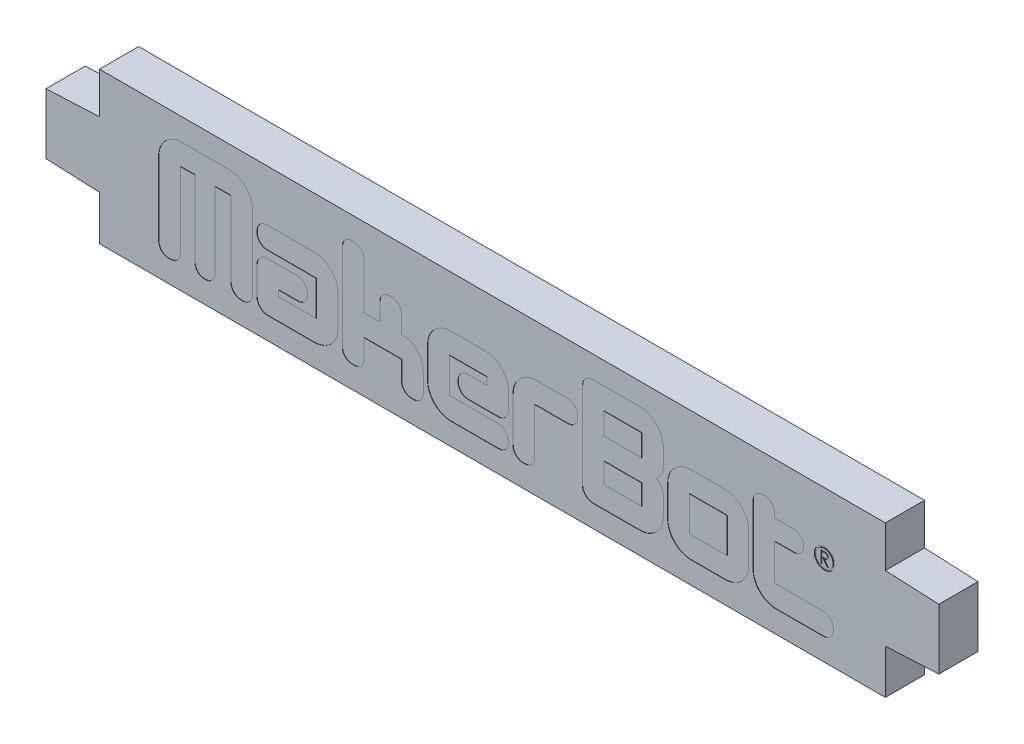
from build123d import *

# Parameters (mm, degrees)
BOSS_EXTRUDE1_DEPTH = 6.4
SKETCH5_W           = 6.148648648
SKETCH5_H           = 3.547297298
SKETCH5_H_2         = 3.310810811
SKETCH5_W_2         = 6.148648649
SKETCH5_H_3         = 5.675675676
CUT_EXTRUDE3_DEPTH  = 0.05
SKETCH11_R          = 1.655
SKETCH11_R_2        = 1.405
CUT_EXTRUDE6_DEPTH  = 0.1
CUT_EXTRUDE7_DEPTH  = 0.1


with BuildPart() as part:
    # Sketch1 → Boss-Extrude1 (new body)
    with BuildSketch(Plane.XY):
        Polygon((63.31728793, 2.089265908), (-65.18271207, 2.089265908), (-65.18271207, 9.364487271), (-73.93271207, 9.764487271), (-73.93271207, 19.664487271), (-65.18271207, 20.064487271), (-65.18271207, 26.809708634), (63.31728793, 26.809708634), (63.31728793, 20.064487271), (72.06728793, 19.664487271), (72.06728793, 9.764487271), (63.31728793, 9.364487271), align=None)
    extrude(amount=BOSS_EXTRUDE1_DEPTH)

    # Sketch5 → Cut-Extrude3 (cut)
    # profile 1 of 8: a face of its own
    with BuildSketch(Plane.XY.offset(6.4)):
        with BuildLine():
            add(Edge.make_bspline(
                [(-41.897176837, 5.680549813), (-42.025779806, 5.685864392), (-42.273995534, 5.696122025), (-42.62809114, 5.785149455), (-42.94019404, 5.939774007), (-43.209577411, 6.149072184), (-43.430201601, 6.406640025), (-43.581460915, 6.712239714), (-43.683874665, 7.049824022), (-43.692322648, 7.289574607), (-43.696691195, 7.413552347)],
                knots=[0, 0, 0, 0, 1.097172578, 2.117645432, 3.091403139, 4.050852726, 5.013813102, 5.959381721, 6.944773204, 8, 8, 8, 8], degree=3))
            Line((-43.696691195, 7.413552347), (-43.696691195, 19.633252516))
            Line((-43.696691195, 19.633252516), (-46.298042546, 19.633252516))
            Line((-46.298042546, 19.633252516), (-46.298042546, 7.413552347))
            add(Edge.make_bspline(
                [(-46.298042546, 7.413552347), (-46.303921163, 7.289954322), (-46.315228965, 7.052207571), (-46.396100328, 6.712274166), (-46.539380918, 6.410964897), (-46.735132537, 6.151328403), (-46.979936248, 5.939263768), (-47.268786576, 5.786220541), (-47.599524345, 5.695496881), (-47.832152411, 5.685672423), (-47.953447952, 5.680549813)],
                knots=[0, 0, 0, 0, 1.097972027, 2.112002056, 3.081338975, 4.042298254, 4.981317233, 5.93608619, 6.923846351, 8, 8, 8, 8], degree=3))
            add(Edge.make_bspline(
                [(-47.953447952, 5.680549813), (-48.074720706, 5.685696599), (-48.30730507, 5.695567423), (-48.638346678, 5.785968718), (-48.926937026, 5.940614327), (-49.175749845, 6.148787762), (-49.366853265, 6.41243888), (-49.511071843, 6.712048382), (-49.591589758, 7.052270648), (-49.602948341, 7.289975898), (-49.608853357, 7.413552347)],
                knots=[0, 0, 0, 0, 1.075918024, 2.063461914, 3.018021823, 3.965152157, 4.919335687, 5.888460369, 6.902268375, 8, 8, 8, 8], degree=3))
            Line((-49.608853357, 7.413552347), (-49.608853357, 19.633252516))
            Line((-49.608853357, 19.633252516), (-51.973718222, 19.633252516))
            Line((-51.973718222, 19.633252516), (-51.973718222, 7.413552347))
            add(Edge.make_bspline(
                [(-51.973718222, 7.413552347), (-51.978609645, 7.289747287), (-51.988055484, 7.050667051), (-52.083313102, 6.710496809), (-52.241267, 6.407745944), (-52.460448049, 6.148892263), (-52.730319591, 5.939822841), (-53.04228888, 5.785135679), (-53.396422035, 5.696125844), (-53.644632393, 5.685865695), (-53.77323258, 5.680549813)],
                knots=[0, 0, 0, 0, 1.054966195, 2.037247655, 2.987425122, 3.950147683, 4.909360322, 5.882877547, 6.903098382, 8, 8, 8, 8], degree=3))
            add(Edge.make_bspline(
                [(-53.77323258, 5.680549813), (-53.898315763, 5.685332409), (-54.139908299, 5.694569778), (-54.480812981, 5.790721453), (-54.786671197, 5.940734427), (-55.047751843, 6.152253744), (-55.263056827, 6.412314756), (-55.40898607, 6.719082566), (-55.507691241, 7.058926733), (-55.516455442, 7.299477393), (-55.521015519, 7.424637651)],
                knots=[0, 0, 0, 0, 1.078530095, 2.083132322, 3.035265688, 4.004502848, 4.965462051, 5.927128535, 6.921469905, 8, 8, 8, 8], degree=3))
            Line((-55.521015519, 7.424637651), (-55.521015519, 19.315473799))
            add(Edge.make_bspline(
                [(-55.521015519, 19.315473799), (-55.517226477, 19.446190309), (-55.509761278, 19.703728906), (-55.457784963, 20.082853835), (-55.368197866, 20.446338858), (-55.246042281, 20.795501091), (-55.089211353, 21.131090606), (-54.898109709, 21.453316666), (-54.664598287, 21.756745445), (-54.406183653, 22.047032222), (-54.119158085, 22.310330756), (-53.815913366, 22.546186468), (-53.493150965, 22.742334965), (-53.15438562, 22.901454066), (-52.802268739, 23.028609377), (-52.433102693, 23.117459409), (-52.047871242, 23.169292885), (-51.785424774, 23.176760379), (-51.652244404, 23.180549813)],
                knots=[0, 0, 0, 0, 1.030779681, 2.030849458, 3.010906287, 3.97861049, 4.943336309, 5.927859644, 6.926418741, 7.958159096, 8.989259101, 9.993706395, 10.98324833, 11.960895376, 12.94100034, 13.930494598, 14.949814424, 16, 16, 16, 16], degree=3))
            Line((-51.652244404, 23.180549813), (-44.018165013, 23.180549813))
            add(Edge.make_bspline(
                [(-44.018165013, 23.180549813), (-43.884990403, 23.17674533), (-43.622555286, 23.169248181), (-43.237241421, 23.117630014), (-42.867247542, 23.027717912), (-42.514025603, 22.903276283), (-42.176578762, 22.741151747), (-41.85442101, 22.546352375), (-41.551272165, 22.310284695), (-41.26422011, 22.047044722), (-41.005812592, 21.756742213), (-40.772299328, 21.453317507), (-40.581198163, 21.131090386), (-40.42436711, 20.79550115), (-40.302211558, 20.446338842), (-40.212624452, 20.082853839), (-40.16064814, 19.703728905), (-40.15318294, 19.446190309), (-40.149393898, 19.315473799)],
                knots=[0, 0, 0, 0, 1.050160809, 2.069456595, 3.058927517, 4.04816003, 5.017010697, 6.006529294, 7.0109529, 8.042028588, 9.073744611, 10.072280157, 11.056780273, 12.02148334, 12.989164722, 13.969198437, 14.969244628, 16, 16, 16, 16], degree=3))
            Line((-40.149393898, 19.315473799), (-40.149393898, 7.424637651))
            add(Edge.make_bspline(
                [(-40.149393898, 7.424637651), (-40.15422324, 7.303230992), (-40.163593056, 7.067679665), (-40.261161868, 6.731699474), (-40.412636723, 6.427537208), (-40.625482978, 6.164316085), (-40.884957866, 5.948250641), (-41.187655401, 5.789217278), (-41.530736224, 5.695070623), (-41.772173855, 5.685503261), (-41.897176837, 5.680549813)],
                knots=[0, 0, 0, 0, 1.049433475, 2.036094644, 3.005048059, 3.976818887, 4.947064632, 5.911422194, 6.918650536, 8, 8, 8, 8], degree=3))
        make_face()
    # profile 2 of 8: a face of its own
    with BuildSketch(Plane.XY.offset(6.4)):
        with BuildLine():
            Line((-30.157839844, 5.680549813), (-37.692151499, 5.680549813))
            add(Edge.make_bspline(
                [(-37.692151499, 5.680549813), (-37.804904387, 5.687114784), (-38.028437736, 5.700129882), (-38.35270279, 5.799841918), (-38.652522005, 5.966898241), (-38.922206157, 6.190517595), (-39.147937167, 6.454416509), (-39.31579874, 6.745804582), (-39.421429188, 7.057859133), (-39.433738521, 7.274796071), (-39.439934438, 7.383991536)],
                knots=[0, 0, 0, 0, 1.003924849, 1.990287682, 2.992650562, 4.045507142, 5.096989086, 6.070622535, 7.02884557, 8, 8, 8, 8], degree=3))
            Line((-39.439934438, 7.383991536), (-39.439934438, 12.04351434))
            add(Edge.make_bspline(
                [(-39.439934438, 12.04351434), (-39.433429632, 12.151409301), (-39.420527191, 12.36542159), (-39.319328108, 12.67568845), (-39.153594587, 12.965091322), (-38.924505505, 13.221124947), (-38.660197166, 13.442510576), (-38.36450966, 13.604929989), (-38.045346736, 13.701108992), (-37.825817267, 13.714360265), (-37.714322107, 13.721090353)],
                knots=[0, 0, 0, 0, 0.973230211, 1.930425878, 2.917237436, 3.966087913, 5.017532224, 6.018359482, 6.993559603, 8, 8, 8, 8], degree=3))
            Line((-37.714322107, 13.721090353), (-32.914385452, 13.721090353))
            add(Edge.make_bspline(
                [(-32.914385452, 13.721090353), (-32.789428114, 13.715853206), (-32.548399273, 13.705751329), (-32.204483514, 13.615491281), (-31.899339521, 13.462106866), (-31.639299861, 13.248441379), (-31.425342402, 12.988402896), (-31.272470484, 12.681597814), (-31.17682046, 12.334944104), (-31.167667564, 12.089743679), (-31.162907411, 11.96222211)],
                knots=[0, 0, 0, 0, 1.071862608, 2.067504053, 3.027956681, 3.982975222, 4.937993763, 5.898446391, 6.907043446, 8, 8, 8, 8], degree=3))
            add(Edge.make_bspline(
                [(-31.162907411, 11.96222211), (-31.168146009, 11.833620429), (-31.178208345, 11.586601386), (-31.267330176, 11.234695058), (-31.423339074, 10.926128996), (-31.629815968, 10.657808423), (-31.887435188, 10.441774907), (-32.186169618, 10.282435137), (-32.525732152, 10.188311798), (-32.764748017, 10.178746395), (-32.888519742, 10.173793056)],
                knots=[0, 0, 0, 0, 1.102928933, 2.118513913, 3.087911514, 4.052394887, 5.005508706, 5.951557965, 6.939236919, 8, 8, 8, 8], degree=3))
            Line((-32.888519742, 10.173793056), (-35.892637141, 10.173793056))
            Line((-35.892637141, 10.173793056), (-35.892637141, 9.22784711))
            Line((-35.892637141, 9.22784711), (-29.743988492, 9.22784711))
            Line((-29.743988492, 9.22784711), (-29.743988492, 14.903522786))
            Line((-29.743988492, 14.903522786), (-37.692151499, 14.903522786))
            add(Edge.make_bspline(
                [(-37.692151499, 14.903522786), (-37.818510237, 14.908136533), (-38.061419643, 14.917005905), (-38.404164125, 15.014723411), (-38.711573826, 15.161748416), (-38.97235257, 15.375531966), (-39.180442853, 15.641567405), (-39.335370858, 15.949751959), (-39.424673004, 16.301520534), (-39.434709364, 16.548559422), (-39.439934438, 16.677171435)],
                knots=[0, 0, 0, 0, 1.077329427, 2.071035653, 3.022271821, 3.972808379, 4.92497656, 5.890328168, 6.901674382, 8, 8, 8, 8], degree=3))
            add(Edge.make_bspline(
                [(-39.439934438, 16.677171435), (-39.434753544, 16.805804443), (-39.424802043, 17.05288366), (-39.335323462, 17.402758827), (-39.183702415, 17.710629814), (-38.976028245, 17.975326225), (-38.714328824, 18.188170458), (-38.408929631, 18.340554635), (-38.063768257, 18.43736467), (-37.819702405, 18.44620175), (-37.692151499, 18.450820083)],
                knots=[0, 0, 0, 0, 1.098175809, 2.109384079, 3.060490501, 4.01252881, 4.962935717, 5.918750472, 6.91232116, 8, 8, 8, 8], degree=3))
            Line((-37.692151499, 18.450820083), (-30.157839844, 18.450820083))
            add(Edge.make_bspline(
                [(-30.157839844, 18.450820083), (-30.023416487, 18.44706834), (-29.757272772, 18.439640295), (-29.366440112, 18.386776307), (-28.989685178, 18.302674094), (-28.629307877, 18.179808144), (-28.285250169, 18.020793127), (-27.957716375, 17.825269294), (-27.642085846, 17.601189581), (-27.349060786, 17.339293319), (-27.082893803, 17.053148867), (-26.842168425, 16.753429263), (-26.642691521, 16.434145008), (-26.478977469, 16.099915536), (-26.351532902, 15.749483625), (-26.265588064, 15.383372718), (-26.206342602, 15.002733202), (-26.199949083, 14.743635744), (-26.196691195, 14.611609779)],
                knots=[0, 0, 0, 0, 1.050330879, 2.079541602, 3.076651564, 4.062923053, 5.049194541, 6.033114514, 7.040210619, 8.069826392, 9.098181484, 10.091893812, 11.069389041, 12.033714251, 12.995923234, 13.976494365, 14.968900403, 16, 16, 16, 16], degree=3))
            Line((-26.196691195, 14.611609779), (-26.196691195, 9.545625826))
            add(Edge.make_bspline(
                [(-26.196691195, 9.545625826), (-26.199961444, 9.413604471), (-26.206379221, 9.154516059), (-26.265448672, 8.773810909), (-26.352312463, 8.406814019), (-26.477942531, 8.054448734), (-26.643756068, 7.718790573), (-26.841897802, 7.39638529), (-27.083012128, 7.093258803), (-27.347724913, 6.803089016), (-27.643266199, 6.541563028), (-27.957574964, 6.313627248), (-28.284286391, 6.113885266), (-28.629339137, 5.955117609), (-28.990215367, 5.833514971), (-29.36586566, 5.743333375), (-29.757349822, 5.692065868), (-30.023442344, 5.684414401), (-30.157839844, 5.680549813)],
                knots=[0, 0, 0, 0, 1.02823351, 2.017881014, 2.995726508, 3.964293243, 4.925937974, 5.908858825, 6.907358576, 7.939884608, 8.966638418, 9.976562025, 10.962665069, 11.946195076, 12.929725084, 13.926238779, 14.952588665, 16, 16, 16, 16], degree=3))
        make_face()
    # profile 3 of 8: a face of its own
    with BuildSketch(Plane.XY.offset(6.4)):
        with BuildLine():
            add(Edge.make_bspline(
                [(-14.002856735, 5.680549813), (-14.131420869, 5.686056244), (-14.378065836, 5.696620104), (-14.729128276, 5.781756712), (-15.038347476, 5.929505863), (-15.308069625, 6.128759568), (-15.523032038, 6.38288775), (-15.682663528, 6.677742924), (-15.77677042, 7.01376522), (-15.786333006, 7.250363862), (-15.79128579, 7.372906232)],
                knots=[0, 0, 0, 0, 1.11165758, 2.13266903, 3.100393931, 4.05957168, 5.012094993, 5.95623431, 6.941465223, 8, 8, 8, 8], degree=3))
            Line((-15.79128579, 7.372906232), (-15.79128579, 10.410279543))
            Line((-15.79128579, 10.410279543), (-21.939934438, 10.410279543))
            Line((-21.939934438, 10.410279543), (-21.939934438, 7.372906232))
            add(Edge.make_bspline(
                [(-21.939934438, 7.372906232), (-21.944887222, 7.250363862), (-21.954449807, 7.01376522), (-22.0485567, 6.677742924), (-22.20818819, 6.38288775), (-22.423150602, 6.128759568), (-22.692872752, 5.929505863), (-23.002091951, 5.781756712), (-23.353154392, 5.696620104), (-23.599799358, 5.686056244), (-23.728363492, 5.680549813)],
                knots=[0, 0, 0, 0, 1.058534777, 2.04376569, 2.987905007, 3.94042832, 4.899606069, 5.86733097, 6.88834242, 8, 8, 8, 8], degree=3))
            add(Edge.make_bspline(
                [(-23.728363492, 5.680549813), (-23.855869927, 5.685513753), (-24.100723651, 5.695046129), (-24.447304361, 5.787794127), (-24.756854763, 5.930378598), (-25.017914072, 6.137122952), (-25.228810219, 6.39263997), (-25.380876265, 6.691365057), (-25.472693515, 7.031332225), (-25.482235467, 7.270070765), (-25.487231735, 7.39507684)],
                knots=[0, 0, 0, 0, 1.1024249, 2.117013491, 3.085962871, 4.035923036, 4.97594201, 5.935206377, 6.918851784, 8, 8, 8, 8], degree=3))
            Line((-25.487231735, 7.39507684), (-25.487231735, 21.491888495))
            add(Edge.make_bspline(
                [(-25.487231735, 21.491888495), (-25.48203219, 21.615600523), (-25.472055011, 21.852986101), (-25.382568581, 22.190311305), (-25.22746274, 22.484021438), (-25.017844839, 22.735341011), (-24.756483438, 22.938194688), (-24.446997344, 23.077263384), (-24.100195236, 23.165042191), (-23.855793514, 23.175235214), (-23.728363492, 23.180549813)],
                knots=[0, 0, 0, 0, 1.077450175, 2.067471824, 3.013888997, 3.951735592, 4.901255681, 5.871921522, 6.890428899, 8, 8, 8, 8], degree=3))
            add(Edge.make_bspline(
                [(-23.728363492, 23.180549813), (-23.599915322, 23.174582932), (-23.353782397, 23.163149169), (-23.001460365, 23.084256487), (-22.693895944, 22.93475246), (-22.42476792, 22.740170632), (-22.20598053, 22.492330087), (-22.049721019, 22.198853029), (-21.953862073, 21.864814357), (-21.944702444, 21.629276918), (-21.939934438, 21.506668901)],
                knots=[0, 0, 0, 0, 1.116575212, 2.139586118, 3.111591937, 4.068628304, 5.009178948, 5.957494847, 6.93678259, 8, 8, 8, 8], degree=3))
            Line((-21.939934438, 21.506668901), (-21.939934438, 13.95757684))
            Line((-21.939934438, 13.95757684), (-19.338583087, 13.95757684))
            Line((-19.338583087, 13.95757684), (-19.338583087, 16.813890185))
            add(Edge.make_bspline(
                [(-19.338583087, 16.813890185), (-19.333589422, 16.930315565), (-19.323905903, 17.156083065), (-19.229086158, 17.477229361), (-19.069382861, 17.761054628), (-18.853060925, 18.005007588), (-18.590892337, 18.20671302), (-18.283815968, 18.347772852), (-17.942877889, 18.43463802), (-17.703423705, 18.445307781), (-17.579714844, 18.450820083)],
                knots=[0, 0, 0, 0, 1.034404173, 2.005875728, 2.948390345, 3.911784286, 4.889854289, 5.870869924, 6.900030674, 8, 8, 8, 8], degree=3))
            add(Edge.make_bspline(
                [(-17.579714844, 18.450820083), (-17.451046483, 18.447068828), (-17.204120013, 18.439869823), (-16.855299593, 18.351417128), (-16.544511202, 18.213935264), (-16.276261054, 18.021404801), (-16.059873497, 17.778787429), (-15.899183754, 17.493738274), (-15.805902269, 17.165715639), (-15.796274272, 16.933965265), (-15.79128579, 16.813890185)],
                knots=[0, 0, 0, 0, 1.127268985, 2.16333331, 3.136231652, 4.096728943, 5.038846223, 5.968466367, 6.947416733, 8, 8, 8, 8], degree=3))
            Line((-15.79128579, 16.813890185), (-15.79128579, 13.95757684))
            add(Edge.make_bspline(
                [(-15.79128579, 13.95757684), (-15.666816871, 13.95417816), (-15.424718614, 13.947567558), (-15.07192128, 13.91254997), (-14.740777635, 13.844881803), (-14.429059443, 13.752548293), (-14.13693608, 13.636103988), (-13.86803948, 13.489091006), (-13.61774671, 13.319689382), (-13.468115867, 13.185836451), (-13.393165013, 13.118788833)],
                knots=[0, 0, 0, 0, 1.146992141, 2.230956948, 3.261329012, 4.255835517, 5.223036112, 6.152212439, 7.074433756, 8, 8, 8, 8], degree=3))
            add(Edge.make_bspline(
                [(-13.393165013, 13.118788833), (-13.301138251, 13.024567279), (-13.120034811, 12.839144613), (-12.887857125, 12.532265774), (-12.685242956, 12.215638969), (-12.525893937, 11.878190991), (-12.401468972, 11.527522323), (-12.305709095, 11.162265659), (-12.255782345, 10.781184958), (-12.247946767, 10.522488776), (-12.243988492, 10.391804036)],
                knots=[0, 0, 0, 0, 1.037659156, 2.042054284, 3.028393422, 3.99721662, 4.977270681, 5.959632339, 6.969273853, 8, 8, 8, 8], degree=3))
            Line((-12.243988492, 10.391804036), (-12.243988492, 7.413552347))
            add(Edge.make_bspline(
                [(-12.243988492, 7.413552347), (-12.24884182, 7.290958433), (-12.25821238, 7.054260272), (-12.354265854, 6.716823058), (-12.511558693, 6.416088664), (-12.727780776, 6.15661145), (-12.991003077, 5.943927662), (-13.297138782, 5.790734131), (-13.63874237, 5.695024679), (-13.879038238, 5.685472047), (-14.002856735, 5.680549813)],
                knots=[0, 0, 0, 0, 1.06007163, 2.046732969, 3.011090696, 3.981336608, 4.953107603, 5.922061184, 6.929289699, 8, 8, 8, 8], degree=3))
        make_face()
    # profile 4 of 8: a face of its own
    with BuildSketch(Plane.XY.offset(6.4)):
        with BuildLine():
            add(Edge.make_bspline(
                [(1.70871421, 11.925271097), (1.702195116, 11.813716895), (1.689269458, 11.592534119), (1.588493611, 11.27122463), (1.421833953, 10.970487502), (1.194922196, 10.700421684), (0.930375352, 10.467423969), (0.633767142, 10.298387238), (0.31538314, 10.191893716), (0.094774389, 10.179876295), (-0.016898121, 10.173793056)],
                knots=[0, 0, 0, 0, 0.985856275, 1.954694889, 2.949846526, 4.01047301, 5.061478972, 6.052443501, 7.014143725, 8, 8, 8, 8], degree=3))
            Line((-0.016898121, 10.173793056), (-4.842700485, 10.173793056))
            add(Edge.make_bspline(
                [(-4.842700485, 10.173793056), (-4.963983003, 10.180390135), (-5.199193353, 10.193184241), (-5.536744455, 10.286808234), (-5.836590358, 10.449340987), (-6.09705857, 10.669141768), (-6.309616255, 10.938806248), (-6.455713002, 11.252063897), (-6.554709734, 11.59537031), (-6.563672431, 11.837078861), (-6.568312817, 11.96222211)],
                knots=[0, 0, 0, 0, 1.044620582, 2.025894397, 2.989966281, 3.961721063, 4.944830322, 5.922826219, 6.924554906, 8, 8, 8, 8], degree=3))
            add(Edge.make_bspline(
                [(-6.568312817, 11.96222211), (-6.563052326, 12.085964302), (-6.552856869, 12.325791415), (-6.462115994, 12.6676059), (-6.31245181, 12.97379715), (-6.103538924, 13.237106607), (-5.847728479, 13.453391689), (-5.550660996, 13.610780616), (-5.218032497, 13.70654023), (-4.984997101, 13.716141205), (-4.864871094, 13.721090353)],
                knots=[0, 0, 0, 0, 1.079259531, 2.091733582, 3.063612737, 4.036444133, 5.006177331, 5.968722784, 6.952909191, 8, 8, 8, 8], degree=3))
            Line((-4.864871094, 13.721090353), (-1.838583087, 13.721090353))
            Line((-1.838583087, 13.721090353), (-1.838583087, 14.903522786))
            Line((-1.838583087, 14.903522786), (-7.987231735, 14.903522786))
            Line((-7.987231735, 14.903522786), (-7.987231735, 9.22784711))
            Line((-7.987231735, 9.22784711), (-0.035373627, 9.22784711))
            add(Edge.make_bspline(
                [(-0.035373627, 9.22784711), (0.087172793, 9.22283257), (0.324967586, 9.213102122), (0.664155051, 9.118521461), (0.966265871, 8.959242564), (1.228610567, 8.744244375), (1.445618655, 8.481986384), (1.59835516, 8.174570532), (1.694287003, 7.833127678), (1.703808183, 7.592809078), (1.70871421, 7.468978867)],
                knots=[0, 0, 0, 0, 1.056737795, 2.050543336, 3.011868241, 3.98727903, 4.962689818, 5.928596123, 6.932656991, 8, 8, 8, 8], degree=3))
            add(Edge.make_bspline(
                [(1.70871421, 7.468978867), (1.703989166, 7.343873563), (1.694862954, 7.102238301), (1.596870207, 6.75789123), (1.445849705, 6.445399282), (1.230029299, 6.175533765), (0.966289195, 5.957179541), (0.665193917, 5.792597758), (0.323465016, 5.699789958), (0.084649544, 5.687115705), (-0.039068729, 5.680549813)],
                knots=[0, 0, 0, 0, 1.068668576, 2.064085243, 3.040544155, 4.023985364, 4.997705895, 5.955703039, 6.940952669, 8, 8, 8, 8], degree=3))
            Line((-0.039068729, 5.680549813), (-7.599246094, 5.680549813))
            add(Edge.make_bspline(
                [(-7.599246094, 5.680549813), (-7.733650353, 5.684348958), (-7.998535191, 5.69183634), (-8.388720308, 5.743701693), (-8.763099838, 5.833645772), (-9.123283176, 5.954166616), (-9.466005123, 6.115130883), (-9.791850165, 6.31228822), (-10.102841497, 6.543041201), (-10.398372324, 6.801799546), (-10.65918235, 7.093521651), (-10.897111544, 7.396343988), (-11.090640437, 7.719836193), (-11.257271686, 8.054311921), (-11.382207394, 8.40689587), (-11.470725002, 8.773450421), (-11.523559531, 9.154874393), (-11.530824571, 9.413666903), (-11.534529033, 9.545625826)],
                knots=[0, 0, 0, 0, 1.050346174, 2.070029458, 3.069335378, 4.055621229, 5.033178088, 6.022044186, 7.027036563, 8.05666733, 9.085577886, 10.080981704, 11.061614361, 12.025953614, 12.997234265, 13.977819675, 14.968885388, 16, 16, 16, 16], degree=3))
            Line((-11.534529033, 9.545625826), (-11.534529033, 14.637475489))
            add(Edge.make_bspline(
                [(-11.534529033, 14.637475489), (-11.530698215, 14.768192487), (-11.523114943, 15.026952524), (-11.471382566, 15.407269403), (-11.383081922, 15.771708392), (-11.255228834, 16.119332588), (-11.09291611, 16.451073155), (-10.895456169, 16.768598871), (-10.660517486, 17.06746818), (-10.396910675, 17.351860471), (-10.10279265, 17.606818104), (-9.792777672, 17.834500117), (-9.464848512, 18.023368003), (-9.122474782, 18.180093974), (-8.763725861, 18.302772517), (-8.388122819, 18.386359403), (-7.998618818, 18.439885029), (-7.733678502, 18.447139247), (-7.599246094, 18.450820083)],
                knots=[0, 0, 0, 0, 1.027519689, 2.034020337, 3.010977592, 3.969771956, 4.939794884, 5.909721152, 6.903330935, 7.924076098, 8.953373544, 9.958569226, 10.943412041, 11.922669826, 12.914768702, 13.917770091, 14.943463239, 16, 16, 16, 16], degree=3))
            Line((-7.599246094, 18.450820083), (-2.355897276, 18.450820083))
            add(Edge.make_bspline(
                [(-2.355897276, 18.450820083), (-2.210389345, 18.447193685), (-1.925822176, 18.440101604), (-1.510443505, 18.386982077), (-1.115093322, 18.30339229), (-0.740695589, 18.179869081), (-0.384900696, 18.025286459), (-0.048889733, 17.835107938), (0.265412818, 17.609213779), (0.555947579, 17.350144949), (0.821499948, 17.068501208), (1.051865556, 16.762911455), (1.247835738, 16.440677025), (1.412810165, 16.10103928), (1.542032355, 15.743155983), (1.633402886, 15.366399036), (1.695247907, 14.973262628), (1.704171482, 14.704226769), (1.70871421, 14.567268563)],
                knots=[0, 0, 0, 0, 1.111057715, 2.172875013, 3.193252923, 4.192820254, 5.178569043, 6.15171339, 7.135934791, 8.128884309, 9.120585283, 10.08766324, 11.046008316, 11.99689065, 12.966983738, 13.945795306, 14.954265092, 16, 16, 16, 16], degree=3))
            Line((1.70871421, 14.567268563), (1.70871421, 11.925271097))
        make_face()
    # profile 5 of 8: a face of its own
    with BuildSketch(Plane.XY.offset(6.4)):
        with BuildLine():
            Line((11.290112015, 14.903522786), (5.965470967, 14.903522786))
            Line((5.965470967, 14.903522786), (5.965470967, 7.391381739))
            add(Edge.make_bspline(
                [(5.965470967, 7.391381739), (5.960570378, 7.268809853), (5.951108566, 7.032154222), (5.855997454, 6.695475651), (5.697631436, 6.397514582), (5.481149039, 6.140662005), (5.215090462, 5.932029765), (4.902423231, 5.786927559), (4.552969332, 5.695224903), (4.305748597, 5.68557414), (4.177041913, 5.680549813)],
                knots=[0, 0, 0, 0, 1.05417575, 2.0353495, 2.984959206, 3.94166006, 4.909773255, 5.873513082, 6.892920206, 8, 8, 8, 8], degree=3))
            add(Edge.make_bspline(
                [(4.177041913, 5.680549813), (4.053211448, 5.685455773), (3.812892354, 5.694976821), (3.471452992, 5.790909593), (3.164024481, 5.943642734), (2.901813881, 6.160663413), (2.686639236, 6.42296123), (2.529125786, 6.723133362), (2.432632466, 7.056662651), (2.423091754, 7.289719948), (2.41817367, 7.409857245)],
                knots=[0, 0, 0, 0, 1.07293491, 2.082256137, 3.053222907, 4.033743955, 5.014265003, 5.980626371, 6.9590453, 8, 8, 8, 8], degree=3))
            Line((2.41817367, 7.409857245), (2.41817367, 14.611609779))
            add(Edge.make_bspline(
                [(2.41817367, 14.611609779), (2.421858311, 14.743577039), (2.42908448, 15.002385899), (2.482200884, 15.383691309), (2.569401267, 15.74955715), (2.697421166, 16.098980377), (2.856238602, 16.434262499), (3.052920277, 16.752021794), (3.285415276, 17.054302253), (3.548389183, 17.339229111), (3.837376044, 17.599682848), (4.146803522, 17.827525155), (4.472889494, 18.019618183), (4.812716597, 18.179113701), (5.167787624, 18.303327539), (5.539889009, 18.386670206), (5.927000942, 18.439670681), (6.190699623, 18.447078393), (6.323895798, 18.450820083)],
                knots=[0, 0, 0, 0, 1.038056793, 2.03579505, 3.022982443, 3.991683793, 4.95829852, 5.937270353, 6.925788701, 7.954484843, 8.983819842, 9.982028619, 10.97258745, 11.956725903, 12.93132312, 13.92571428, 14.952262782, 16, 16, 16, 16], degree=3))
            Line((6.323895798, 18.450820083), (11.27902671, 18.450820083))
            add(Edge.make_bspline(
                [(11.27902671, 18.450820083), (11.401626359, 18.445971421), (11.638335592, 18.436609869), (11.975694747, 18.340492885), (12.276715403, 18.183432954), (12.535717715, 17.965836844), (12.75276534, 17.705129749), (12.905327503, 17.397496347), (13.001307446, 17.056113514), (13.010821823, 16.815786424), (13.015724346, 16.69195184)],
                knots=[0, 0, 0, 0, 1.059182306, 2.045015908, 3.00856461, 3.977996555, 4.955663724, 5.923804423, 6.930187947, 8, 8, 8, 8], degree=3))
            add(Edge.make_bspline(
                [(13.015724346, 16.69195184), (13.010982385, 16.566858959), (13.001823503, 16.325247691), (12.904061494, 15.980731163), (12.752526789, 15.669551912), (12.541146261, 15.398586603), (12.280791967, 15.180320791), (11.983466141, 15.015591094), (11.646505836, 14.923091973), (11.411360836, 14.910180423), (11.290112015, 14.903522786)],
                knots=[0, 0, 0, 0, 1.076074821, 2.07839007, 3.061616182, 4.045301101, 5.017624893, 5.972919341, 6.954767741, 8, 8, 8, 8], degree=3))
        make_face()
    # profile 6 of 8: a face of its own
    with BuildSketch(Plane.XY.offset(6.4)):
        with BuildLine():
            Line((23.051619616, 5.680549813), (15.569039379, 5.680549813))
            add(Edge.make_bspline(
                [(15.569039379, 5.680549813), (15.452631701, 5.687156948), (15.221924161, 5.700251582), (14.88757567, 5.798866079), (14.579339085, 5.966676243), (14.301800175, 6.19073645), (14.064426166, 6.459271512), (13.89553982, 6.771740016), (13.786513119, 7.112002848), (13.775249811, 7.351132034), (13.769525021, 7.472673968)],
                knots=[0, 0, 0, 0, 0.990535739, 1.96313566, 2.939292749, 3.961535373, 4.987806502, 5.968966819, 6.967688943, 8, 8, 8, 8], degree=3))
            Line((13.769525021, 7.472673968), (13.769525021, 21.366255049))
            add(Edge.make_bspline(
                [(13.769525021, 21.366255049), (13.775123597, 21.498812811), (13.785871545, 21.753292517), (13.8901335, 22.11247277), (14.053415902, 22.431096679), (14.287473035, 22.700525851), (14.580000109, 22.917330327), (14.926357889, 23.072918836), (15.322709932, 23.166884452), (15.602976104, 23.17584569), (15.750099346, 23.180549813)],
                knots=[0, 0, 0, 0, 1.045650009, 2.007401942, 2.930823142, 3.856090981, 4.802636784, 5.787479896, 6.838557191, 8, 8, 8, 8], degree=3))
            Line((15.750099346, 23.180549813), (23.051619616, 23.180549813))
            add(Edge.make_bspline(
                [(23.051619616, 23.180549813), (23.184821782, 23.176869289), (23.447311202, 23.169616415), (23.833139389, 23.116098704), (24.205057112, 23.032470566), (24.562780141, 22.908988353), (24.904597355, 22.749854294), (25.234457935, 22.559456026), (25.549183381, 22.333408442), (25.844431018, 22.073022665), (26.116250865, 21.790018593), (26.360312181, 21.491707399), (26.55831163, 21.170129777), (26.728116269, 20.838203112), (26.852061971, 20.486916343), (26.946172269, 20.122583317), (27.00240277, 19.740922955), (27.009280208, 19.480705291), (27.012768265, 19.348729712)],
                knots=[0, 0, 0, 0, 1.042828434, 2.055007348, 3.044739657, 4.0238873, 5.012161526, 5.993207663, 7.002348792, 8.041289146, 9.07137122, 10.073109783, 11.052589928, 12.023148391, 12.987311249, 13.962841574, 14.966806637, 16, 16, 16, 16], degree=3))
            Line((27.012768265, 19.348729712), (27.012768265, 16.547842887))
            add(Edge.make_bspline(
                [(27.012768265, 16.547842887), (27.009028502, 16.449071106), (27.001591416, 16.25264845), (26.947458538, 15.962570918), (26.863581065, 15.680113635), (26.740432741, 15.407899333), (26.577945477, 15.149697581), (26.390035281, 14.895515547), (26.161798558, 14.65396807), (25.989432483, 14.506565685), (25.900542758, 14.430549813)],
                knots=[0, 0, 0, 0, 0.956898274, 1.902937244, 2.850857384, 3.807234248, 4.787963026, 5.80268749, 6.866839048, 8, 8, 8, 8], degree=3))
            add(Edge.make_bspline(
                [(25.900542758, 14.430549813), (25.989687191, 14.366149357), (26.163641437, 14.240479897), (26.390933608, 14.020269682), (26.580623372, 13.780110977), (26.741890318, 13.525365612), (26.864779567, 13.249002591), (26.949304357, 12.952874018), (27.001763741, 12.639049253), (27.009058541, 12.423084311), (27.012768265, 12.313256739)],
                knots=[0, 0, 0, 0, 1.055966995, 2.060587928, 3.029347072, 3.991793122, 4.950957476, 5.924982241, 6.944763158, 8, 8, 8, 8], degree=3))
            Line((27.012768265, 12.313256739), (27.012768265, 9.512369914))
            add(Edge.make_bspline(
                [(27.012768265, 9.512369914), (27.00940222, 9.3803618), (27.002765355, 9.120079987), (26.94483119, 8.739181909), (26.857227144, 8.373425673), (26.730508094, 8.024089901), (26.566953897, 7.68967344), (26.365986175, 7.370362003), (26.128940418, 7.067594354), (25.860124147, 6.784688701), (25.56632743, 6.526453035), (25.25170963, 6.302580522), (24.925138635, 6.106048461), (24.579168509, 5.952491305), (24.219909268, 5.8283987), (23.842981908, 5.744675992), (23.452196397, 5.691708229), (23.186046231, 5.684294384), (23.051619616, 5.680549813)],
                knots=[0, 0, 0, 0, 1.031720516, 2.034254399, 3.006058065, 3.968846482, 4.9337524, 5.911836268, 6.913722191, 7.935685411, 8.959553166, 9.967255735, 10.951768215, 11.934630292, 12.921495704, 13.919206117, 14.949036621, 16, 16, 16, 16], degree=3))
        make_face()
        with Locations((20.391146643, 17.859603867)):
            Rectangle(SKETCH5_W, SKETCH5_H, mode=Mode.SUBTRACT)
        with Locations((20.391146643, 10.883252516)):
            Rectangle(SKETCH5_W, SKETCH5_H_2, mode=Mode.SUBTRACT)
    # profile 7 of 8: a face of its own
    with BuildSketch(Plane.XY.offset(6.4)):
        with BuildLine():
            Line((37.004322319, 5.680549813), (31.657510663, 5.680549813))
            add(Edge.make_bspline(
                [(31.657510663, 5.680549813), (31.523106404, 5.684348958), (31.258221566, 5.69183634), (30.868036449, 5.743701693), (30.493656919, 5.833645772), (30.133473581, 5.954166616), (29.790751634, 6.115130883), (29.464906591, 6.31228822), (29.15391526, 6.543041201), (28.858384433, 6.801799546), (28.597574407, 7.093521651), (28.359645213, 7.396343988), (28.16611632, 7.719836193), (27.999485071, 8.054311921), (27.874549363, 8.40689587), (27.786031755, 8.773450421), (27.733197225, 9.154874393), (27.725932185, 9.413666903), (27.722227724, 9.545625826)],
                knots=[0, 0, 0, 0, 1.050346174, 2.070029458, 3.069335378, 4.055621229, 5.033178088, 6.022044186, 7.027036563, 8.05666733, 9.085577886, 10.080981704, 11.061614361, 12.025953614, 12.997234265, 13.977819675, 14.968885388, 16, 16, 16, 16], degree=3))
            Line((27.722227724, 9.545625826), (27.722227724, 14.611609779))
            add(Edge.make_bspline(
                [(27.722227724, 14.611609779), (27.725919867, 14.743573293), (27.733160749, 15.002374807), (27.786170462, 15.383733491), (27.873766302, 15.749401863), (28.000521579, 16.100053031), (28.165052095, 16.433087514), (28.359914923, 16.753472414), (28.597453323, 17.05288664), (28.859729733, 17.340590508), (29.15272259, 17.599706197), (29.465067914, 17.826599658), (29.79170827, 18.019556924), (30.133442286, 18.180761947), (30.49312605, 18.302545329), (30.868607828, 18.386421744), (31.258144759, 18.439868746), (31.52308055, 18.447133766), (31.657510663, 18.450820083)],
                knots=[0, 0, 0, 0, 1.034008227, 2.027855166, 3.01119239, 3.97611567, 4.943161147, 5.918314854, 6.908874786, 7.933558871, 8.966079089, 9.968189359, 10.954884872, 11.935185048, 12.924238711, 13.924161422, 14.946706242, 16, 16, 16, 16], degree=3))
            Line((31.657510663, 18.450820083), (37.004322319, 18.450820083))
            add(Edge.make_bspline(
                [(37.004322319, 18.450820083), (37.138745675, 18.44706834), (37.40488939, 18.439640295), (37.79572205, 18.386776307), (38.172476984, 18.302674094), (38.532854285, 18.179808144), (38.876911993, 18.020793127), (39.204445787, 17.825269294), (39.520076316, 17.601189581), (39.813101376, 17.339293319), (40.079268359, 17.053148867), (40.319993737, 16.753429263), (40.519470641, 16.434145008), (40.683184693, 16.099915536), (40.81062926, 15.749483625), (40.896574098, 15.383372718), (40.95581956, 15.002733202), (40.962213079, 14.743635744), (40.965470967, 14.611609779)],
                knots=[0, 0, 0, 0, 1.050330879, 2.079541602, 3.076651564, 4.062923053, 5.049194541, 6.033114514, 7.040210619, 8.069826392, 9.098181484, 10.091893812, 11.069389041, 12.033714251, 12.995923234, 13.976494365, 14.968900403, 16, 16, 16, 16], degree=3))
            Line((40.965470967, 14.611609779), (40.965470967, 9.545625826))
            add(Edge.make_bspline(
                [(40.965470967, 9.545625826), (40.962200718, 9.413604471), (40.955782942, 9.154516059), (40.89671349, 8.773810909), (40.809849699, 8.406814019), (40.684219631, 8.054448734), (40.518406094, 7.718790573), (40.32026436, 7.39638529), (40.079150034, 7.093258803), (39.814437249, 6.803089016), (39.518895963, 6.541563028), (39.204587198, 6.313627248), (38.877875772, 6.113885266), (38.532823025, 5.955117609), (38.171946796, 5.833514971), (37.796296502, 5.743333375), (37.40481234, 5.692065868), (37.138719818, 5.684414401), (37.004322319, 5.680549813)],
                knots=[0, 0, 0, 0, 1.02823351, 2.017881014, 2.995726508, 3.964293243, 4.925937974, 5.908858825, 6.907358576, 7.939884608, 8.966638418, 9.976562025, 10.962665069, 11.946195076, 12.929725084, 13.926238779, 14.952588665, 16, 16, 16, 16], degree=3))
        make_face()
        with Locations((34.343849346, 12.065684948)):
            Rectangle(SKETCH5_W_2, SKETCH5_H_3, mode=Mode.SUBTRACT)
    # profile 8 of 8: a face of its own
    with BuildSketch(Plane.XY.offset(6.4)):
        with BuildLine():
            Line((53.092793602, 5.680549813), (45.584347656, 5.680549813))
            add(Edge.make_bspline(
                [(45.584347656, 5.680549813), (45.449919224, 5.684207733), (45.186207827, 5.69138356), (44.799036693, 5.744707884), (44.427950287, 5.829616288), (44.070497088, 5.94734577), (43.7298605, 6.104487721), (43.403564724, 6.292483013), (43.095290568, 6.516835253), (42.805504807, 6.769860965), (42.539889349, 7.047935488), (42.311162549, 7.34955064), (42.111864995, 7.664352804), (41.954295265, 7.999237682), (41.826784007, 8.347461281), (41.73845411, 8.711839366), (41.685930497, 9.092053002), (41.678645212, 9.350848604), (41.674930427, 9.482809103)],
                knots=[0, 0, 0, 0, 1.060945594, 2.081281748, 3.078990397, 4.062911222, 5.046255362, 6.035207837, 7.031019519, 8.050892285, 9.068816513, 10.060632756, 11.03460644, 12.004445988, 12.97637912, 13.957413129, 14.958480041, 16, 16, 16, 16], degree=3))
            Line((41.674930427, 9.482809103), (41.674930427, 19.12702363))
            add(Edge.make_bspline(
                [(41.674930427, 19.12702363), (41.679672336, 19.248411169), (41.688779733, 19.481550312), (41.785263315, 19.812986488), (41.94280074, 20.106282809), (42.158966915, 20.358799227), (42.423482508, 20.562865018), (42.727688666, 20.714434594), (43.07090074, 20.798936863), (43.310180118, 20.809979834), (43.43379867, 20.815684948)],
                knots=[0, 0, 0, 0, 1.061346446, 2.038441531, 2.9946847, 3.95941935, 4.928852704, 5.903978258, 6.917135384, 8, 8, 8, 8], degree=3))
            add(Edge.make_bspline(
                [(43.43379867, 20.815684948), (43.562362674, 20.810178483), (43.809007392, 20.799614558), (44.160071552, 20.7144784), (44.469284677, 20.566727661), (44.739029042, 20.367479764), (44.953909443, 20.113330138), (45.114418039, 19.81750544), (45.207888529, 19.477450729), (45.217320303, 19.237231195), (45.222227724, 19.112243225)],
                knots=[0, 0, 0, 0, 1.107295974, 2.12430147, 3.088229486, 4.043643886, 4.992429959, 5.93286493, 6.924454593, 8, 8, 8, 8], degree=3))
            Line((45.222227724, 19.112243225), (45.222227724, 18.450820083))
            Line((45.222227724, 18.450820083), (48.226345123, 18.450820083))
            add(Edge.make_bspline(
                [(48.226345123, 18.450820083), (48.349999049, 18.445249999), (48.588152274, 18.434522208), (48.927060424, 18.349499913), (49.225781287, 18.201944145), (49.481878847, 18.001370262), (49.691189702, 17.755257558), (49.846547813, 17.469352403), (49.93661659, 17.143149294), (49.94671603, 16.914223146), (49.951957454, 16.795414678)],
                knots=[0, 0, 0, 0, 1.103227754, 2.124778862, 3.093651484, 4.057204544, 5.009076976, 5.958723398, 6.940614919, 8, 8, 8, 8], degree=3))
            add(Edge.make_bspline(
                [(49.951957454, 16.795414678), (49.946698596, 16.676619584), (49.936565564, 16.447719207), (49.846732084, 16.121335585), (49.690065959, 15.835252124), (49.483108798, 15.586121189), (49.226584227, 15.384555607), (48.926033716, 15.242274575), (48.588291958, 15.156005478), (48.350046788, 15.145476255), (48.226345123, 15.140009272)],
                knots=[0, 0, 0, 0, 1.058909349, 2.040359936, 2.989579905, 3.949432887, 4.91255325, 5.876175302, 6.897267667, 8, 8, 8, 8], degree=3))
            Line((48.226345123, 15.140009272), (45.222227724, 15.140009272))
            Line((45.222227724, 15.140009272), (45.222227724, 9.22784711))
            Line((45.222227724, 9.22784711), (53.100183805, 9.22784711))
            add(Edge.make_bspline(
                [(53.100183805, 9.22784711), (53.222880321, 9.223371671), (53.460116829, 9.214718309), (53.795414423, 9.11361249), (54.095800647, 8.955942575), (54.353592345, 8.736346736), (54.565286804, 8.470302502), (54.71786692, 8.165704829), (54.815596059, 7.828412892), (54.824750069, 7.591621216), (54.829491237, 7.468978867)],
                knots=[0, 0, 0, 0, 1.063063285, 2.055457075, 3.013072741, 3.992920254, 4.975802804, 5.947490894, 6.936936715, 8, 8, 8, 8], degree=3))
            add(Edge.make_bspline(
                [(54.829491237, 7.468978867), (54.824742544, 7.34264542), (54.815568984, 7.098593522), (54.718177025, 6.751741153), (54.567883502, 6.438052638), (54.349360963, 6.173485123), (54.091806439, 5.9510321), (53.788669505, 5.795793219), (53.452838276, 5.693489383), (53.215528178, 5.684960745), (53.092793602, 5.680549813)],
                knots=[0, 0, 0, 0, 1.081786141, 2.089802565, 3.068616103, 4.04617248, 5.014132627, 5.969479429, 6.949833643, 8, 8, 8, 8], degree=3))
        make_face()
    extrude(amount=-CUT_EXTRUDE3_DEPTH, mode=Mode.SUBTRACT)

    # Sketch11 → Cut-Extrude6 (cut)
    with BuildSketch(Plane.XY.offset(6.4)):
        with Locations((53.357361486, 16.786799084)):
            Circle(SKETCH11_R)
        with Locations((53.357361486, 16.786799084)):
            Circle(SKETCH11_R_2, mode=Mode.SUBTRACT)
    extrude(amount=-CUT_EXTRUDE6_DEPTH, mode=Mode.SUBTRACT)

    # Sketch12 → Cut-Extrude7 (cut)
    with BuildSketch(Plane.XY.offset(6.4)):
        with BuildLine():
            Line((52.777154418, 17.802437759), (53.177394803, 17.802437759))
            add(Edge.make_bspline(
                [(53.177394803, 17.802437759), (53.204104019, 17.802348853), (53.255388673, 17.802178143), (53.328859113, 17.801226279), (53.395617454, 17.798498075), (53.455628791, 17.796150313), (53.508892022, 17.791869204), (53.555570474, 17.787777406), (53.595449159, 17.782421028), (53.619589645, 17.777446501), (53.630519803, 17.775194169)],
                knots=[0, 0, 0, 0, 1.410062039, 2.707475311, 3.878576406, 4.937260626, 5.877586885, 6.699081471, 7.410979367, 8, 8, 8, 8], degree=3))
            add(Edge.make_bspline(
                [(53.630519803, 17.775194169), (53.645152159, 17.771578875), (53.674104725, 17.76442541), (53.715790477, 17.749305638), (53.755512948, 17.73180871), (53.793107133, 17.711258012), (53.828384728, 17.687500995), (53.861709477, 17.660947783), (53.893232599, 17.631743665), (53.921679245, 17.599152327), (53.94850156, 17.564960036), (53.971123632, 17.527986461), (53.990624478, 17.48932273), (54.006150488, 17.448575635), (54.018652187, 17.406140336), (54.027467181, 17.361632453), (54.032753573, 17.315254753), (54.033291777, 17.283621662), (54.033564675, 17.26758199)],
                knots=[0, 0, 0, 0, 1.027469482, 2.033020251, 3.019912614, 3.986113645, 4.951240523, 5.91722682, 6.890402269, 7.87763091, 8.8651537, 9.85103654, 10.82876324, 11.815024772, 12.821070561, 13.842952187, 14.906261191, 16, 16, 16, 16], degree=3))
            add(Edge.make_bspline(
                [(54.033564675, 17.26758199), (54.032725247, 17.240933359), (54.031087307, 17.188934977), (54.015815819, 17.113471616), (53.990800665, 17.043077722), (53.956330214, 16.977841929), (53.91243337, 16.919035846), (53.859676347, 16.867384157), (53.798029712, 16.82416135), (53.740641531, 16.794188319), (53.689947703, 16.774992371), (53.648214381, 16.76148588), (53.602690394, 16.751050472), (53.553811917, 16.741701825), (53.501375543, 16.734643714), (53.445506949, 16.729474231), (53.386166291, 16.726243346), (53.345401108, 16.725762201), (53.324430059, 16.725514682)],
                knots=[0, 0, 0, 0, 1.260483769, 2.459530307, 3.627416485, 4.787058657, 5.939039949, 7.08810263, 8.267026773, 9.491475466, 10.141966685, 10.831826277, 11.566392101, 12.351337768, 13.187381173, 14.07005841, 15.007169909, 16, 16, 16, 16], degree=3))
            Line((53.324430059, 16.725514682), (54.0592057, 15.802437759))
            Line((54.0592057, 15.802437759), (53.837250572, 15.802437759))
            Line((53.837250572, 15.802437759), (53.102474931, 16.725514682))
            Line((53.102474931, 16.725514682), (52.956641598, 16.725514682))
            Line((52.956641598, 16.725514682), (52.956641598, 15.802437759))
            Line((52.956641598, 15.802437759), (52.777154418, 15.802437759))
            Line((52.777154418, 15.802437759), (52.777154418, 17.802437759))
        make_face()
        with BuildLine():
            Line((52.956641598, 17.597309554), (52.956641598, 16.930642887))
            Line((52.956641598, 16.930642887), (53.322827495, 16.9278384))
            add(Edge.make_bspline(
                [(53.322827495, 16.9278384), (53.33992466, 16.927830836), (53.373063836, 16.927816176), (53.421007073, 16.930098333), (53.465647136, 16.932694515), (53.506813281, 16.93666557), (53.544523895, 16.941783325), (53.578760131, 16.94818503), (53.609577875, 16.955643352), (53.645519897, 16.967187138), (53.685655058, 16.985476291), (53.729273035, 17.012085148), (53.766417228, 17.045553216), (53.797798864, 17.083823762), (53.823015682, 17.125901619), (53.840793998, 17.171282401), (53.852075394, 17.218820457), (53.853405991, 17.251493662), (53.854077495, 17.267982631)],
                knots=[0, 0, 0, 0, 1.146690395, 2.22261258, 3.21895312, 4.145990853, 4.996080663, 5.770904154, 6.481378293, 7.121626537, 8.300444488, 9.431385265, 10.535395872, 11.636531494, 12.74115979, 13.810798291, 14.895190096, 16, 16, 16, 16], degree=3))
            add(Edge.make_bspline(
                [(53.854077495, 17.267982631), (53.853390569, 17.284066387), (53.852029331, 17.315938524), (53.840915749, 17.362599044), (53.822121817, 17.406637301), (53.796794824, 17.44787415), (53.765938164, 17.485305999), (53.729756557, 17.517332943), (53.689239302, 17.543761209), (53.651370046, 17.560649426), (53.617521925, 17.571003628), (53.588133548, 17.578290008), (53.554926989, 17.58414399), (53.517741013, 17.58883431), (53.476734366, 17.592865707), (53.431699709, 17.595581009), (53.382935834, 17.597188931), (53.349137588, 17.597268411), (53.331641598, 17.597309554)],
                knots=[0, 0, 0, 0, 1.101028733, 2.181837193, 3.264309656, 4.369019818, 5.486613113, 6.575447106, 7.666700264, 8.788928104, 9.402425223, 10.0903467, 10.862060571, 11.710948788, 12.657782767, 13.684531032, 14.801375019, 16, 16, 16, 16], degree=3))
            Line((53.331641598, 17.597309554), (52.956641598, 17.597309554))
        make_face(mode=Mode.SUBTRACT)
    extrude(amount=-CUT_EXTRUDE7_DEPTH, mode=Mode.SUBTRACT)


solid = part.part
